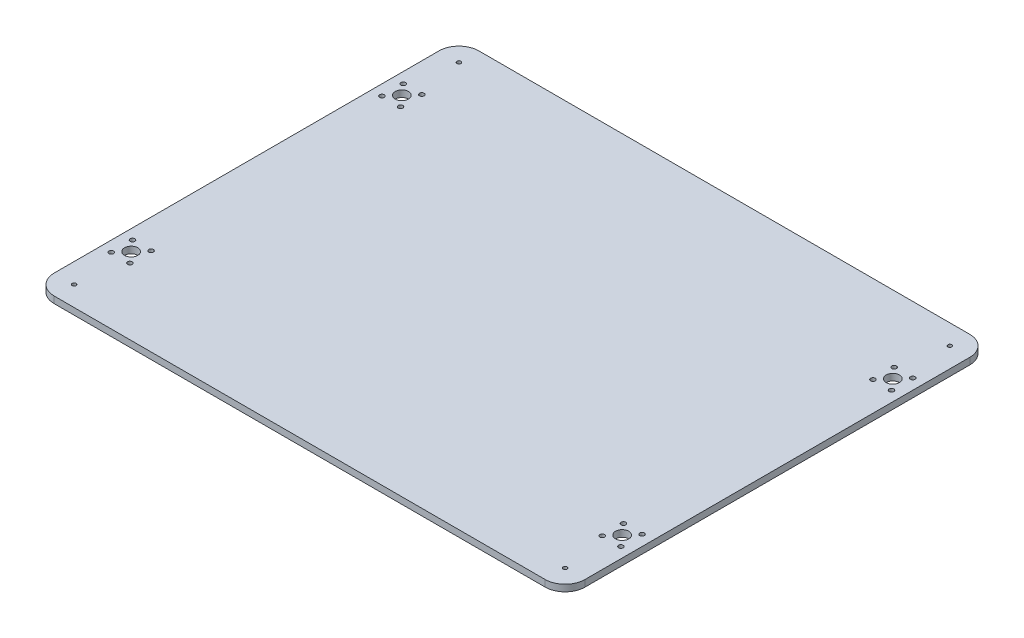
from build123d import *

# Parameters (mm, degrees)
EXTRUDE_1_DEPTH                              = 5
FILLET_1_R                                   = 15
SKETCH_2_R                                   = 1.75
SKETCH_2_R_2                                 = 5
CUT_EXTRUDE_2_DEPTH                          = 257.173769149
MIRROR_1_AT_THE_SECOND_PLANE_COPY_1_SKET_R   = 1.75
MIRROR_1_AT_THE_SECOND_PLANE_COPY_1_SKET_R_2 = 5
MIRROR_1_AT_THE_SECOND_PLANE_COPY_1_DEPTH    = 257.173769149
SKETCH_3_R                                   = 1.5
CUT_EXTRUDE_3_DEPTH                          = 257.173769149
MIRROR_2_AT_THE_SECOND_PLANE_COPY_1_SKET_R   = 1.5
MIRROR_2_AT_THE_SECOND_PLANE_COPY_1_DEPTH    = 257.173769149


with BuildPart() as part:
    # 草图1 → 凸台-拉伸1 (new body)
    with BuildSketch(Plane(origin=(0, 0, 0), x_dir=(1, 0, 0), z_dir=(0, 1, 0))):
        Polygon((200, 0), (200, -160), (-200, -160), (-200, 0), (-200, 160), (200, 160), align=None)
    extrude(amount=EXTRUDE_1_DEPTH)

    # 圆角1
    fillet_1_edges = [part.edges().sort_by_distance(p)[0] for p in [
        (-200, 2.5, 160),
        (-200, 2.5, -160),
        (200, 2.5, -160),
        (200, 2.5, 160),
    ]]
    fillet(fillet_1_edges, radius=FILLET_1_R)

    # 草图2 → 切除-拉伸2 (cut, through all)
    with BuildSketch(Plane(origin=(0, 5, 0), x_dir=(1, 0, 0), z_dir=(0, 1, 0))):
        with Locations(Location((-192, 110, 0), (0, 0, 270))):
            Circle(SKETCH_2_R)
        with Locations(Location((-178, 110, 0), (0, 0, 270))):
            Circle(SKETCH_2_R)
        with Locations(Location((-178, 94, 0), (0, 0, 270))):
            Circle(SKETCH_2_R)
        with Locations(Location((-185, 102, 0), (0, 0, 270))):
            Circle(SKETCH_2_R_2)
        with Locations(Location((-192, 94, 0), (0, 0, 270))):
            Circle(SKETCH_2_R)
    cut_extrude_2 = extrude(amount=-CUT_EXTRUDE_2_DEPTH, mode=Mode.SUBTRACT)

    # 镜向1: 切除-拉伸2 across plane
    add(cut_extrude_2.mirror(Plane(origin=(0, 0, 0), x_dir=(0, 0, 1), z_dir=(1, 0, 0))), mode=Mode.SUBTRACT)

    # 镜向1 at the second plane: 切除-拉伸2 across plane
    add(cut_extrude_2.mirror(Plane.XY), mode=Mode.SUBTRACT)

    # 镜向1 at the second plane copy 1 sket → 镜向1 at the second plane copy 1 (cut, through all)
    with BuildSketch(Plane(origin=(0, 5, 0), x_dir=(-1, 0, 0), z_dir=(0, 1, 0))):
        with Locations(Location((-192, 110, 0), (0, 0, 270))):
            Circle(MIRROR_1_AT_THE_SECOND_PLANE_COPY_1_SKET_R)
        with Locations(Location((-178, 110, 0), (0, 0, 270))):
            Circle(MIRROR_1_AT_THE_SECOND_PLANE_COPY_1_SKET_R)
        with Locations(Location((-178, 94, 0), (0, 0, 270))):
            Circle(MIRROR_1_AT_THE_SECOND_PLANE_COPY_1_SKET_R)
        with Locations(Location((-185, 102, 0), (0, 0, 270))):
            Circle(MIRROR_1_AT_THE_SECOND_PLANE_COPY_1_SKET_R_2)
        with Locations(Location((-192, 94, 0), (0, 0, 270))):
            Circle(MIRROR_1_AT_THE_SECOND_PLANE_COPY_1_SKET_R)
    extrude(amount=-MIRROR_1_AT_THE_SECOND_PLANE_COPY_1_DEPTH, mode=Mode.SUBTRACT)

    # 草图3 → 切除-拉伸3 (cut, through all)
    with BuildSketch(Plane(origin=(0, 5, 0), x_dir=(1, 0, 0), z_dir=(0, 1, 0))):
        with Locations(Location((185, -145, 0), (0, 0, 270))):
            Circle(SKETCH_3_R)
    cut_extrude_3 = extrude(amount=-CUT_EXTRUDE_3_DEPTH, mode=Mode.SUBTRACT)

    # 镜向2: 切除-拉伸3 across plane
    add(cut_extrude_3.mirror(Plane.XY), mode=Mode.SUBTRACT)

    # 镜向2 at the second plane: 切除-拉伸3 across plane
    add(cut_extrude_3.mirror(Plane(origin=(0, 0, 0), x_dir=(0, 0, 1), z_dir=(1, 0, 0))), mode=Mode.SUBTRACT)

    # 镜向2 at the second plane copy 1 sket → 镜向2 at the second plane copy 1 (cut, through all)
    with BuildSketch(Plane(origin=(0, 5, 0), x_dir=(-1, 0, 0), z_dir=(0, 1, 0))):
        with Locations(Location((185, -145, 0), (0, 0, 270))):
            Circle(MIRROR_2_AT_THE_SECOND_PLANE_COPY_1_SKET_R)
    extrude(amount=-MIRROR_2_AT_THE_SECOND_PLANE_COPY_1_DEPTH, mode=Mode.SUBTRACT)


solid = part.part
